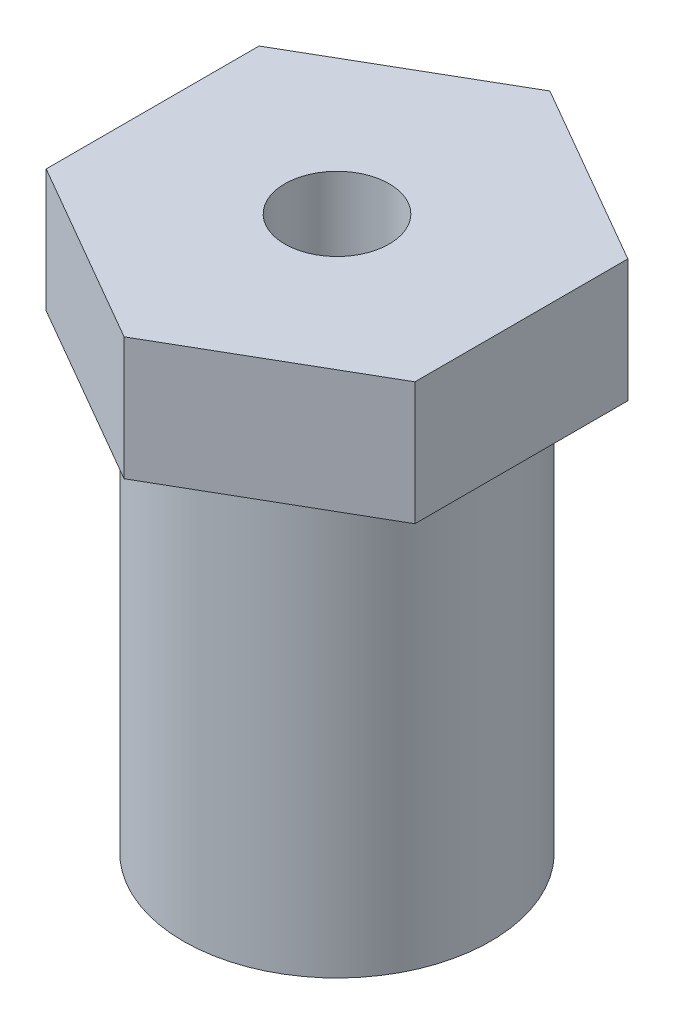
from build123d import *

# Parameters (mm, degrees)
SKETCH1_R                 = 5
SKETCH1_R_2               = 3
BOSS_EXTRUDE1_DEPTH       = 14
BOSS_EXTRUDE2_DEPTH       = 4
M3_CLEARANCE_HOLE1_D      = 3.4
M3_CLEARANCE_HOLE2_REACH  = 25.495
M3_CLEARANCE_HOLE2_BORE_R = 1.7
BOSS_EXTRUDE3_REACH       = 25.495
BOSS_EXTRUDE3_END_RADIUS  = 5
SKETCH11_R                = 2.549362178
SKETCH11_R_2              = 1.7
SKETCH14_R                = 2.549362178
CUT_EXTRUDE2_DEPTH        = 1


with BuildPart() as part:
    # Sketch1 → Boss-Extrude1 (new body)
    with BuildSketch(Plane(origin=(0, 0, 0), x_dir=(1, 0, 0), z_dir=(0, 1, 0))):
        with Locations(Location((0, 0, 0), (0, 0, 270))):
            Circle(SKETCH1_R)
        with Locations(Location((0, 0, 0), (0, 0, 270))):
            Circle(SKETCH1_R_2, mode=Mode.SUBTRACT)
    extrude(amount=BOSS_EXTRUDE1_DEPTH)

    # Sketch2 → Boss-Extrude2 (add)
    with BuildSketch(Plane(origin=(0, 14, 0), x_dir=(1, 0, 0), z_dir=(0, 1, 0))):
        Polygon((0, 6.92820323), (-6, 3.464101615), (-6, -3.464101615), (0, -6.92820323), (6, -3.464101615), (6, 3.464101615), align=None)
    extrude(amount=BOSS_EXTRUDE2_DEPTH)

    # M3 Clearance Hole1 (through all)
    with Locations(Plane(origin=(0, 18, 0), x_dir=(1, 0, 0), z_dir=(0, 1, 0))):
        with Locations((0, 0)):
            Hole(M3_CLEARANCE_HOLE1_D / 2)

    # M3 Clearance Hole2 bore → M3 Clearance Hole2 (cut, up to next)
    with BuildSketch(Plane(origin=(-3, 0, -5.196152423), x_dir=(-0.8660254037844386, 0, 0.5000000000000003), z_dir=(-0.5000000000000002, 0, -0.8660254037844385)), mode=Mode.PRIVATE) as m3_clearance_hole2_sk1:
        with Locations((0, 6)):
            Circle(M3_CLEARANCE_HOLE2_BORE_R)
    m3_clearance_hole2_tool1 = extrude(m3_clearance_hole2_sk1.sketch, amount=-M3_CLEARANCE_HOLE2_REACH, mode=Mode.PRIVATE) & part.part
    add(m3_clearance_hole2_tool1.solids().sort_by_distance((-3, 6, -5.196152))[0], mode=Mode.SUBTRACT)

    # Boss-Extrude3: up to this cylinder (the profile starts outside it)
    boss_extrude3_end = Plane(origin=(0, 6, 0), z_dir=(0, -1, 0)) * Cylinder(BOSS_EXTRUDE3_END_RADIUS, 61.99, mode=Mode.PRIVATE)
    # Sketch11 → Boss-Extrude3 (add, up to the surface)
    with BuildSketch(Plane(origin=(-3, 0, -5.196152423), x_dir=(-0.8660254037844386, 0, 0.5000000000000003), z_dir=(-0.5000000000000002, 0, -0.8660254037844385)), mode=Mode.PRIVATE) as boss_extrude3_sk1:
        with Locations((0, 6)):
            Circle(SKETCH11_R)
        with Locations((0, 6)):
            Circle(SKETCH11_R_2, mode=Mode.SUBTRACT)
    boss_extrude3_tool1 = extrude(boss_extrude3_sk1.sketch, amount=-BOSS_EXTRUDE3_REACH, mode=Mode.PRIVATE) - boss_extrude3_end
    add(boss_extrude3_tool1.solids().sort_by_distance((-0.854634, 6, -6.43478))[0])

    # Sketch14 → Cut-Extrude2 (cut)
    with BuildSketch(Plane(origin=(-3, 0, -5.196152423), x_dir=(-0.8660254037844384, 0, 0.5000000000000004), z_dir=(-0.5000000000000004, 0, -0.8660254037844384))):
        with Locations((0, 6)):
            Circle(SKETCH14_R)
    extrude(amount=-CUT_EXTRUDE2_DEPTH, mode=Mode.SUBTRACT)


solid = part.part
